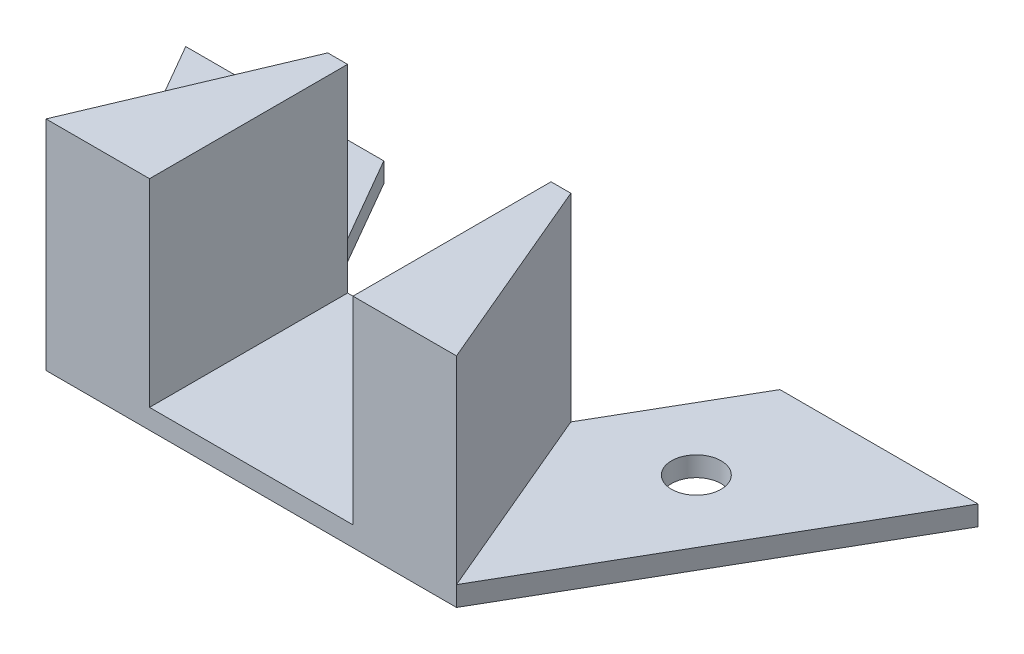
from build123d import *

# Parameters (mm, degrees)
BOSS_EXTRUDE1_DEPTH         = 2.54
BOSS_EXTRUDE2_DEPTH         = 25.4
F_1_4_0_25_DIAMETER_HOLE1_D = 6.35


with BuildPart() as part:
    # Sketch1 → Boss-Extrude1 (new body)
    with BuildSketch(Plane(origin=(0, 0, 0), x_dir=(1, 0, 0), z_dir=(0, 1, 0))):
        Polygon((-26.320348586, -42.4), (-50.8, 0), (-25.4, 0), (-15.585045424, -17), (15.585045424, -17), (25.4, 0), (50.8, 0), (26.320348586, -42.4), align=None)
    extrude(amount=BOSS_EXTRUDE1_DEPTH)

    # Sketch2 → Boss-Extrude2 (add)
    with BuildSketch(Plane(origin=(0, 2.54, 0), x_dir=(1, 0, 0), z_dir=(0, 1, 0))):
        Polygon((-26.320348586, -42.4), (-15.585045424, -17), (-13.045045424, -17), (-13.045045424, -42.4), align=None)
        Polygon((15.585045424, -17), (26.320348586, -42.4), (13.045045424, -42.4), (13.045045424, -17), align=None)
    extrude(amount=BOSS_EXTRUDE2_DEPTH)

    # 1/4 (0.25) Diameter Hole1 (through all)
    with Locations(Plane(origin=(29.526348503, 2.54, 14.85), x_dir=(0, 0, 1), z_dir=(0, 1, 0))):
        with Locations((0, 0), (0, -59.052697006)):
            Hole(F_1_4_0_25_DIAMETER_HOLE1_D / 2)


solid = part.part
